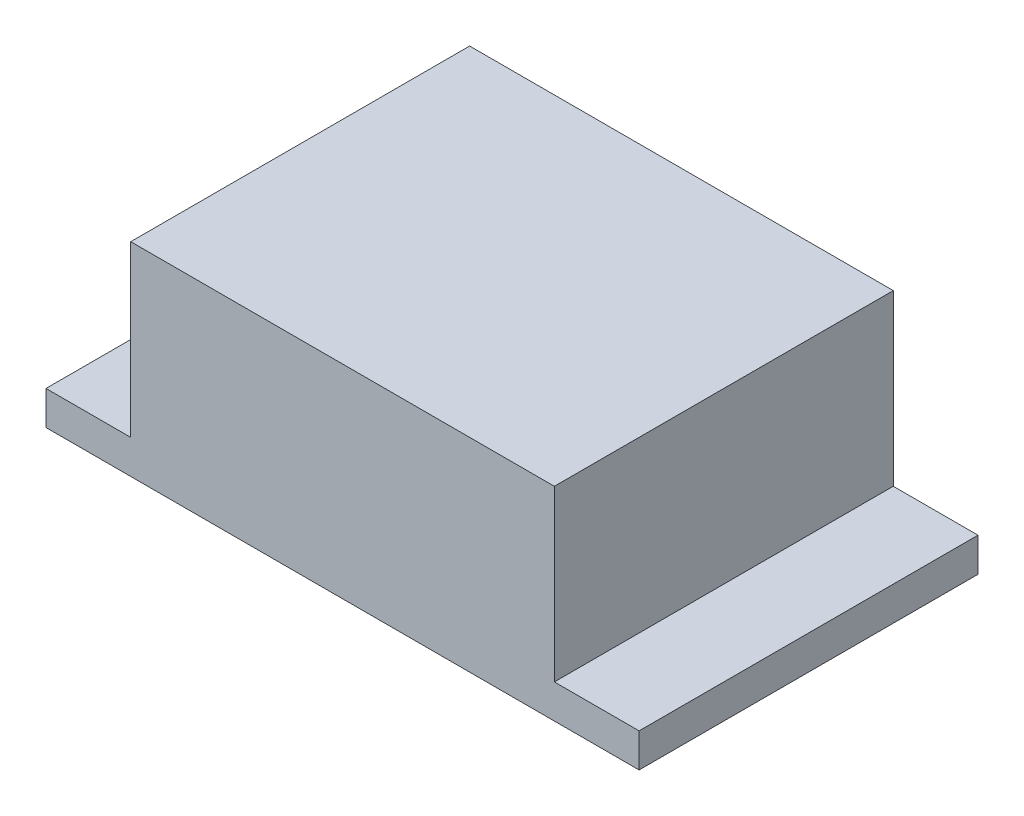
from build123d import *

# Parameters (mm, degrees)
SKETCH_1_W      = 35
SKETCH_1_H      = 20
EXTRUDE_1_DEPTH = 2
SKETCH_2_W      = 25
SKETCH_2_H      = 20
EXTRUDE_2_DEPTH = 10


with BuildPart() as part:
    # 草图1 → 凸台-拉伸1 (new body)
    with BuildSketch(Plane(origin=(0, 0, 0), x_dir=(1, 0, 0), z_dir=(0, 1, 0))):
        Rectangle(SKETCH_1_W, SKETCH_1_H)
    extrude(amount=EXTRUDE_1_DEPTH)

    # 草图2 → 凸台-拉伸2 (add)
    with BuildSketch(Plane(origin=(0, 2, 0), x_dir=(1, 0, 0), z_dir=(0, 1, 0))):
        Rectangle(SKETCH_2_W, SKETCH_2_H)
    extrude(amount=EXTRUDE_2_DEPTH)


solid = part.part
